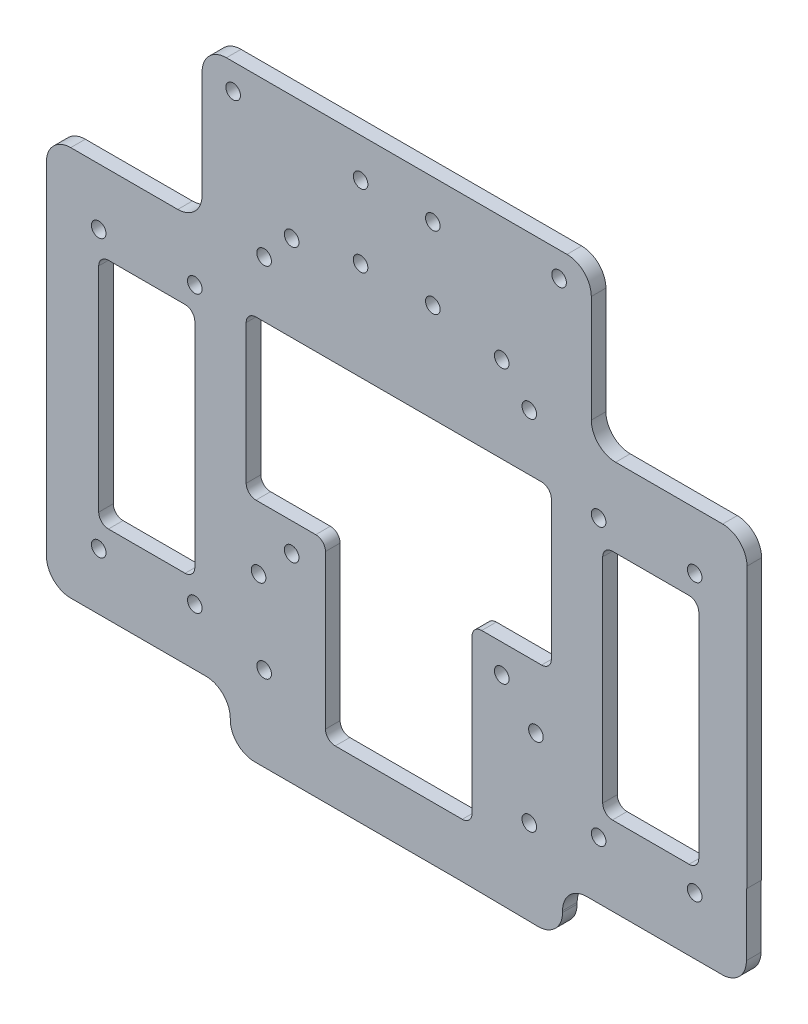
from build123d import *

# Parameters (mm, degrees)
SKETCH_1_W          = 80
SKETCH_1_H          = 97
SKETCH_1_R          = 1.5
EXTRUDE_1_DEPTH     = 3
SKETCH_3_W          = 32
SKETCH_3_H          = 62.377964324
EXTRUDE_2_DEPTH     = 3
EXTRUDE_3_DEPTH     = 3
SKETCH_5_R          = 1.5
CUT_EXTRUDE_2_DEPTH = 3
SKETCH_6_R          = 1.5
CUT_EXTRUDE_4_DEPTH = 3
FILLET_1_R          = 5
FILLET_2_R          = 5
CUT_EXTRUDE_5_DEPTH = 10
SKETCH_9_W          = 35.553305852
SKETCH_9_H          = 40.684386559
EXTRUDE_4_DEPTH     = 3
CUT_EXTRUDE_6_REACH = 159.896
SKETCH_10_R         = 1.5
CUT_EXTRUDE_7_REACH = 159.896
SKETCH_11_R         = 1.5


with BuildPart() as part:
    # 草图1 → 凸台-拉伸1 (new body)
    with BuildSketch(Plane.XY):
        with Locations((33.620020091, -43.208150262)):
            Rectangle(SKETCH_1_W, SKETCH_1_H)
        Circle(SKETCH_1_R, mode=Mode.SUBTRACT)
        with Locations((66.99974208, 0.185906473)):
            Circle(SKETCH_1_R, mode=Mode.SUBTRACT)
        with Locations((5.231118743, -83.287075899)):
            Circle(SKETCH_1_R, mode=Mode.SUBTRACT)
        with Locations((62.230899318, -83.128916661)):
            Circle(SKETCH_1_R, mode=Mode.SUBTRACT)
    extrude(amount=EXTRUDE_1_DEPTH)

    # 草图3 → 凸台-拉伸2 (add)
    with BuildSketch(Plane.XY.offset(3)):
        with Locations((-22.379979909, -57.897132424)):
            Rectangle(SKETCH_3_W, SKETCH_3_H)
        with Locations((89.620020091, -57.897132424)):
            Rectangle(SKETCH_3_W, SKETCH_3_H)
    extrude(amount=-EXTRUDE_2_DEPTH)

    # 草图4 → 凸台-拉伸3 (add)
    with BuildSketch(Plane.XY.offset(3)):
        Polygon((-38.379979909, -89.086114586), (-38.379979909, -106.898150262), (-4.25, -106.898150262), (-0.590540516, -106.898150262), (-0.590540516, -117.135828938), (20.473808019, -117.135828938), (46.526191981, -117.135828938), (67.71, -117.391270189), (67.71, -106.991270189), (71.25, -106.991270189), (105.5, -106.991270189), (105.5, -89.086114586), (72.50067844, -84.475650121), (55.009126254, -90.348726038), (11.990873746, -90.348726038), (-5.50067844, -84.475650121), align=None)
    extrude(amount=-EXTRUDE_3_DEPTH)

    # 草图5 → 切除-拉伸2 (cut)
    with BuildSketch(Plane.XY.offset(3)):
        with Locations((-27.629979909, -38.388150262)):
            Circle(SKETCH_5_R)
        with Locations((-7.879979909, -38.388150262)):
            Circle(SKETCH_5_R)
        with Locations((-27.629979909, -95.218150262)):
            Circle(SKETCH_5_R)
        with Locations((-7.879979909, -95.218150262)):
            Circle(SKETCH_5_R)
        with Locations(Location((75.120020091, -95.218150262, 0), (0, 0, 180))):
            Circle(SKETCH_5_R)
        with Locations(Location((94.870020091, -95.218150262, 0), (0, 0, 180))):
            Circle(SKETCH_5_R)
        with Locations(Location((75.120020091, -38.388150262, 0), (0, 0, 180))):
            Circle(SKETCH_5_R)
        with Locations(Location((94.870020091, -38.388150262, 0), (0, 0, 180))):
            Circle(SKETCH_5_R)
    extrude(amount=-CUT_EXTRUDE_2_DEPTH, mode=Mode.SUBTRACT)

    # 草图6 → 切除-拉伸4 (cut)
    with BuildSketch(Plane.XY.offset(3)):
        with Locations((12.030020091, -20.143150262)):
            Circle(SKETCH_6_R)
        with Locations((55.210020091, -20.143150262)):
            Circle(SKETCH_6_R)
        with Locations((12.030020091, -76.273150262)):
            Circle(SKETCH_6_R)
        with Locations((55.210020091, -76.273150262)):
            Circle(SKETCH_6_R)
    extrude(amount=-CUT_EXTRUDE_4_DEPTH, mode=Mode.SUBTRACT)

    # 圆角1
    fillet_1_edges = [part.edges().sort_by_distance(p)[0] for p in [
        (-6.379979909, 5.291849738, 1.5),
        (73.620020091, 5.291849738, 1.5),
        (-6.379979909, -26.708150262, 1.5),
        (-38.379979909, -26.708150262, 1.5),
        (105.620020091, -26.708150262, 1.5),
        (73.620020091, -26.708150262, 1.5),
        (105.5, -106.991270189, 1.5),
        (67.71, -106.991270189, 1.5),
        (-0.590540516, -117.135828938, 1.5),
        (-0.590540516, -106.898150262, 1.5),
        (-38.379979909, -106.898150262, 1.5),
    ]]
    fillet(fillet_1_edges, radius=FILLET_1_R)

    # 圆角2
    fillet_2_edges = [part.edges().sort_by_distance(p)[0] for p in [
        (67.71, -117.391270189, 1.5),
    ]]
    fillet(fillet_2_edges, radius=FILLET_2_R)

    # 草图8 → 切除-拉伸5 (cut)
    with BuildSketch(Plane.XY.offset(3)):
        with BuildLine():
            Line((-25.629979909, -42.884254011), (-9.879979909, -42.884254011))
            ThreePointArc((-9.879979909, -42.884254011), (-8.465766346, -43.470040449), (-7.879979909, -44.884254011))
            Line((-7.879979909, -44.884254011), (-7.879979909, -88.722046513))
            ThreePointArc((-7.879979909, -88.722046513), (-8.465766346, -90.136260075), (-9.879979909, -90.722046513))
            Line((-9.879979909, -90.722046513), (-25.629979909, -90.722046513))
            ThreePointArc((-25.629979909, -90.722046513), (-27.044193471, -90.136260075), (-27.629979909, -88.722046513))
            Line((-27.629979909, -88.722046513), (-27.629979909, -44.884254011))
            ThreePointArc((-27.629979909, -44.884254011), (-27.044193471, -43.470040449), (-25.629979909, -42.884254011))
        make_face()
        with BuildLine():
            Line((20.981769159, -2.213743129), (47.098456354, -2.213743129))
            ThreePointArc((47.098456354, -2.213743129), (48.512669916, -2.799529566), (49.098456354, -4.213743129))
            Line((49.098456354, -4.213743129), (49.098456354, -35.822296813))
            ThreePointArc((49.098456354, -35.822296813), (49.684242792, -37.236510375), (51.098456354, -37.822296813))
            Line((51.098456354, -37.822296813), (63.396898836, -37.822296813))
            ThreePointArc((63.396898836, -37.822296813), (64.811112398, -38.40808325), (65.396898836, -39.822296813))
            Line((65.396898836, -39.822296813), (65.396898836, -68.419181777))
            ThreePointArc((65.396898836, -68.419181777), (64.811112398, -69.833395339), (63.396898836, -70.419181777))
            Line((63.396898836, -70.419181777), (51.098456354, -70.419181777))
            ThreePointArc((51.098456354, -70.419181777), (49.684242792, -71.004968215), (49.098456354, -72.419181777))
            Line((49.098456354, -72.419181777), (49.098456354, -104.027735461))
            ThreePointArc((49.098456354, -104.027735461), (48.512669916, -105.441949023), (47.098456354, -106.027735461))
            Line((47.098456354, -106.027735461), (20.981769159, -106.027735461))
            ThreePointArc((20.981769159, -106.027735461), (19.567555596, -105.441949023), (18.981769159, -104.027735461))
            Line((18.981769159, -104.027735461), (18.981769159, -72.419181777))
            ThreePointArc((18.981769159, -72.419181777), (18.395982721, -71.004968215), (16.981769159, -70.419181777))
            Line((16.981769159, -70.419181777), (4.683326676, -70.419181777))
            ThreePointArc((4.683326676, -70.419181777), (3.269113114, -69.833395339), (2.683326676, -68.419181777))
            Line((2.683326676, -68.419181777), (2.683326676, -39.822296813))
            ThreePointArc((2.683326676, -39.822296813), (3.269113114, -38.40808325), (4.683326676, -37.822296813))
            Line((4.683326676, -37.822296813), (16.981769159, -37.822296813))
            ThreePointArc((16.981769159, -37.822296813), (18.395982721, -37.236510375), (18.981769159, -35.822296813))
            Line((18.981769159, -35.822296813), (18.981769159, -4.213743129))
            ThreePointArc((18.981769159, -4.213743129), (19.567555596, -2.799529566), (20.981769159, -2.213743129))
        make_face()
        with BuildLine():
            Line((93.710205421, -90.722046513), (77.960205421, -90.722046513))
            ThreePointArc((77.960205421, -90.722046513), (76.545991859, -90.136260075), (75.960205421, -88.722046513))
            Line((75.960205421, -88.722046513), (75.960205421, -44.884254011))
            ThreePointArc((75.960205421, -44.884254011), (76.545991859, -43.470040449), (77.960205421, -42.884254011))
            Line((77.960205421, -42.884254011), (93.710205421, -42.884254011))
            ThreePointArc((93.710205421, -42.884254011), (95.124418984, -43.470040449), (95.710205421, -44.884254011))
            Line((95.710205421, -44.884254011), (95.710205421, -88.722046513))
            ThreePointArc((95.710205421, -88.722046513), (95.124418984, -90.136260075), (93.710205421, -90.722046513))
        make_face()
    extrude(amount=-CUT_EXTRUDE_5_DEPTH, mode=Mode.SUBTRACT)

    # 草图9 → 凸台-拉伸4 (add)
    with BuildSketch(Plane.XY.offset(3)):
        with Locations((35.048637375, -17.480103533)):
            Rectangle(SKETCH_9_W, SKETCH_9_H)
    extrude(amount=-EXTRUDE_4_DEPTH)

    # 草图10 → 切除-拉伸6 (cut, up to next)
    with BuildSketch(Plane.XY.offset(3), mode=Mode.PRIVATE) as cut_extrude_6_sk1:
        with Locations((6.370020091, -26.298500215)):
            Circle(SKETCH_10_R)
    cut_extrude_6_tool1 = extrude(cut_extrude_6_sk1.sketch, amount=-CUT_EXTRUDE_6_REACH, mode=Mode.PRIVATE) & part.part
    # 草图10 → 切除-拉伸6 (cut, up to next)
    with BuildSketch(Plane.XY.offset(3), mode=Mode.PRIVATE) as cut_extrude_6_sk2:
        with Locations((60.870020091, -26.298500215)):
            Circle(SKETCH_10_R)
    cut_extrude_6_tool2 = extrude(cut_extrude_6_sk2.sketch, amount=-CUT_EXTRUDE_6_REACH, mode=Mode.PRIVATE) & part.part
    # 草图10 → 切除-拉伸6 (cut, up to next)
    with BuildSketch(Plane.XY.offset(3), mode=Mode.PRIVATE) as cut_extrude_6_sk3:
        with Locations((6.370020091, -99.798500215)):
            Circle(SKETCH_10_R)
    cut_extrude_6_tool3 = extrude(cut_extrude_6_sk3.sketch, amount=-CUT_EXTRUDE_6_REACH, mode=Mode.PRIVATE) & part.part
    # 草图10 → 切除-拉伸6 (cut, up to next)
    with BuildSketch(Plane.XY.offset(3), mode=Mode.PRIVATE) as cut_extrude_6_sk4:
        with Locations((60.870020091, -99.798500215)):
            Circle(SKETCH_10_R)
    cut_extrude_6_tool4 = extrude(cut_extrude_6_sk4.sketch, amount=-CUT_EXTRUDE_6_REACH, mode=Mode.PRIVATE) & part.part
    add(cut_extrude_6_tool1.solids().sort_by_distance((6.37002, -26.2985, 3))[0], mode=Mode.SUBTRACT)
    add(cut_extrude_6_tool2.solids().sort_by_distance((60.87002, -26.2985, 3))[0], mode=Mode.SUBTRACT)
    add(cut_extrude_6_tool3.solids().sort_by_distance((6.37002, -99.7985, 3))[0], mode=Mode.SUBTRACT)
    add(cut_extrude_6_tool4.solids().sort_by_distance((60.87002, -99.7985, 3))[0], mode=Mode.SUBTRACT)

    # 草图11 → 切除-拉伸7 (cut, up to next)
    with BuildSketch(Plane.XY.offset(3), mode=Mode.PRIVATE) as cut_extrude_7_sk1:
        with Locations((26.195020091, -2.714801131)):
            Circle(SKETCH_11_R)
    cut_extrude_7_tool1 = extrude(cut_extrude_7_sk1.sketch, amount=-CUT_EXTRUDE_7_REACH, mode=Mode.PRIVATE) & part.part
    # 草图11 → 切除-拉伸7 (cut, up to next)
    with BuildSketch(Plane.XY.offset(3), mode=Mode.PRIVATE) as cut_extrude_7_sk2:
        with Locations((41.045020091, -2.714801131)):
            Circle(SKETCH_11_R)
    cut_extrude_7_tool2 = extrude(cut_extrude_7_sk2.sketch, amount=-CUT_EXTRUDE_7_REACH, mode=Mode.PRIVATE) & part.part
    # 草图11 → 切除-拉伸7 (cut, up to next)
    with BuildSketch(Plane.XY.offset(3), mode=Mode.PRIVATE) as cut_extrude_7_sk3:
        with Locations((26.195020091, -17.564801131)):
            Circle(SKETCH_11_R)
    cut_extrude_7_tool3 = extrude(cut_extrude_7_sk3.sketch, amount=-CUT_EXTRUDE_7_REACH, mode=Mode.PRIVATE) & part.part
    # 草图11 → 切除-拉伸7 (cut, up to next)
    with BuildSketch(Plane.XY.offset(3), mode=Mode.PRIVATE) as cut_extrude_7_sk4:
        with Locations((41.045020091, -17.564801131)):
            Circle(SKETCH_11_R)
    cut_extrude_7_tool4 = extrude(cut_extrude_7_sk4.sketch, amount=-CUT_EXTRUDE_7_REACH, mode=Mode.PRIVATE) & part.part
    add(cut_extrude_7_tool1.solids().sort_by_distance((26.19502, -2.714801, 3))[0], mode=Mode.SUBTRACT)
    add(cut_extrude_7_tool2.solids().sort_by_distance((41.04502, -2.714801, 3))[0], mode=Mode.SUBTRACT)
    add(cut_extrude_7_tool3.solids().sort_by_distance((26.19502, -17.564801, 3))[0], mode=Mode.SUBTRACT)
    add(cut_extrude_7_tool4.solids().sort_by_distance((41.04502, -17.564801, 3))[0], mode=Mode.SUBTRACT)


solid = part.part
